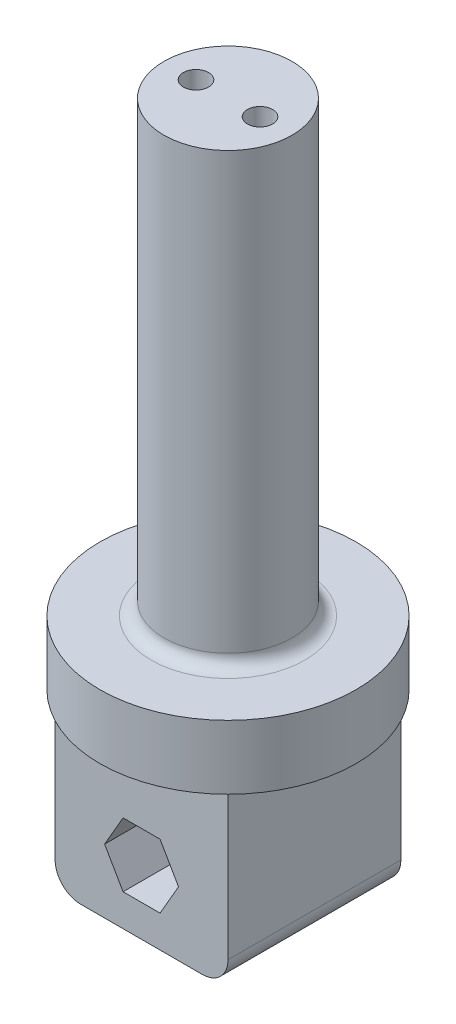
from build123d import *

# Parameters (mm, degrees)
BOSS_EXTRUDE1_DEPTH       = 34.31697226
SKETCH4_R                 = 25.4
BOSS_EXTRUDE2_DEPTH       = 12.7
SKETCH6_R                 = 12.7
BOSS_EXTRUDE3_DEPTH       = 88.9
CUT_EXTRUDE1_DEPTH        = 145.667412963
FILLET1_R                 = 5.08
FILLET2_R                 = 2.54
M6X1_0_TAPPED_HOLE1_D     = 5
M6X1_0_TAPPED_HOLE1_DEPTH = 38.1
M6X1_0_TAPPED_HOLE1_TIP   = 1.502151548


with BuildPart() as part:
    # Sketch3 → Boss-Extrude1 (new body)
    with BuildSketch(Plane(origin=(0, 0, 0), x_dir=(1, 0, 0), z_dir=(0, 1, 0))):
        Polygon((17.145, 0), (17.145, 17.145), (0, 17.145), (-17.145, 17.145), (-17.145, 0), (-17.145, -17.145), (0, -17.145), (17.145, -17.145), align=None)
    extrude(amount=BOSS_EXTRUDE1_DEPTH)

    # Sketch4 → Boss-Extrude2 (add)
    with BuildSketch(Plane(origin=(0, 34.31697226, 0), x_dir=(1, 0, 0), z_dir=(0, 1, 0))):
        with Locations(Location((0, 0, 0), (0, 0, 270))):
            Circle(SKETCH4_R)
    extrude(amount=BOSS_EXTRUDE2_DEPTH)

    # Sketch6 → Boss-Extrude3 (add)
    with BuildSketch(Plane(origin=(0, 47.01697226, 0), x_dir=(1, 0, 0), z_dir=(0, 1, 0))):
        with Locations(Location((0, 0, 0), (0, 0, 270))):
            Circle(SKETCH6_R)
    extrude(amount=BOSS_EXTRUDE3_DEPTH)

    # Sketch7 → Cut-Extrude1 (cut, through all)
    with BuildSketch(Plane.XY.offset(17.145)):
        Polygon((7.332348419, 12.7), (3.666174209, 19.05), (-3.666174209, 19.05), (-7.332348419, 12.7), (-3.666174209, 6.35), (3.666174209, 6.35), align=None)
    extrude(amount=-CUT_EXTRUDE1_DEPTH, mode=Mode.SUBTRACT)

    # Fillet1
    fillet1_edges = [part.edges().sort_by_distance(p)[0] for p in [
        (17.145, 0, 0),
        (-17.145, 0, 0),
    ]]
    fillet(fillet1_edges, radius=FILLET1_R)

    # Fillet2
    fillet2_edges = [part.edges().sort_by_distance(p)[0] for p in [
        (0, 47.01697226, -12.7),
    ]]
    fillet(fillet2_edges, radius=FILLET2_R)

    # M6x1.0 Tapped Hole1
    with Locations(Plane(origin=(0, 135.91697226, 0), x_dir=(1, 0, 0), z_dir=(0, 1, 0))):
        with Locations((6.35, 0), (-6.35, 0)):
            Hole(M6X1_0_TAPPED_HOLE1_D / 2, depth=M6X1_0_TAPPED_HOLE1_DEPTH)
            with Locations((0, 0, -(M6X1_0_TAPPED_HOLE1_DEPTH + M6X1_0_TAPPED_HOLE1_TIP / 2))):  # 118° drill point
                Cone(0, M6X1_0_TAPPED_HOLE1_D / 2, M6X1_0_TAPPED_HOLE1_TIP, mode=Mode.SUBTRACT)


solid = part.part
